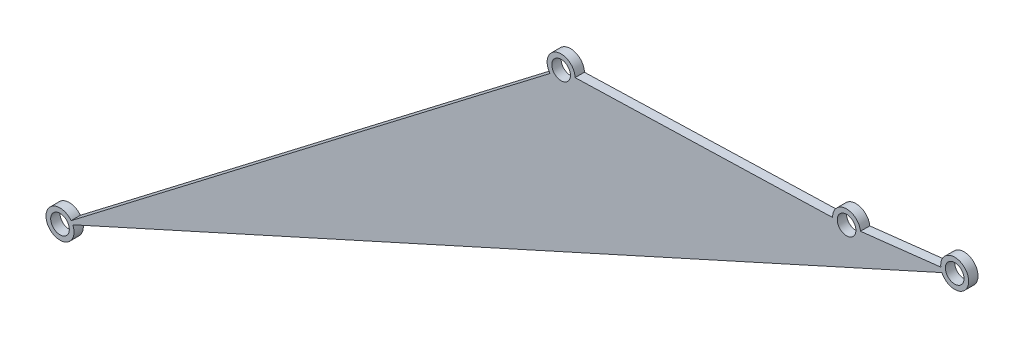
from build123d import *

# Parameters (mm, degrees)
ESBO_O1_R                = 1
RESSALTO_EXTRUS_O1_DEPTH = 1


with BuildPart() as part:
    # Esboço1 → Ressalto-extrusão1 (new body)
    with BuildSketch(Plane.XY):
        with BuildLine():
            Line((-43.966105598, -24.410653491), (7.400239219, 14.945193852))
            ThreePointArc((7.400239219, 14.945193852), (8.088262348, 17.270743925), (10.090268532, 15.901974328))
            Line((10.090268532, 15.901974328), (37.708107977, 16.721635469))
            ThreePointArc((37.708107977, 16.721635469), (39.10051177, 18.262317276), (40.697875743, 16.935321765))
            Line((40.697875743, 16.935321765), (49.312549281, 17.91322761))
            ThreePointArc((49.312549281, 17.91322761), (52.249068588, 18.480937464), (49.436288485, 17.464223044))
            Line((49.436288485, 17.464223044), (-43.79010635, -24.704743106))
            ThreePointArc((-43.79010635, -24.704743106), (-46.443911265, -26.093215977), (-43.966105598, -24.410653491))
        make_face()
        with Locations((-45.156795094, -25.322935534)):
            Circle(ESBO_O1_R, mode=Mode.SUBTRACT)
        with Locations((8.590928714, 15.857475895)):
            Circle(ESBO_O1_R, mode=Mode.SUBTRACT)
        with Locations((39.207447795, 16.766133903)):
            Circle(ESBO_O1_R, mode=Mode.SUBTRACT)
        with Locations((50.802977228, 18.082415472)):
            Circle(ESBO_O1_R, mode=Mode.SUBTRACT)
    extrude(amount=RESSALTO_EXTRUS_O1_DEPTH)


solid = part.part
